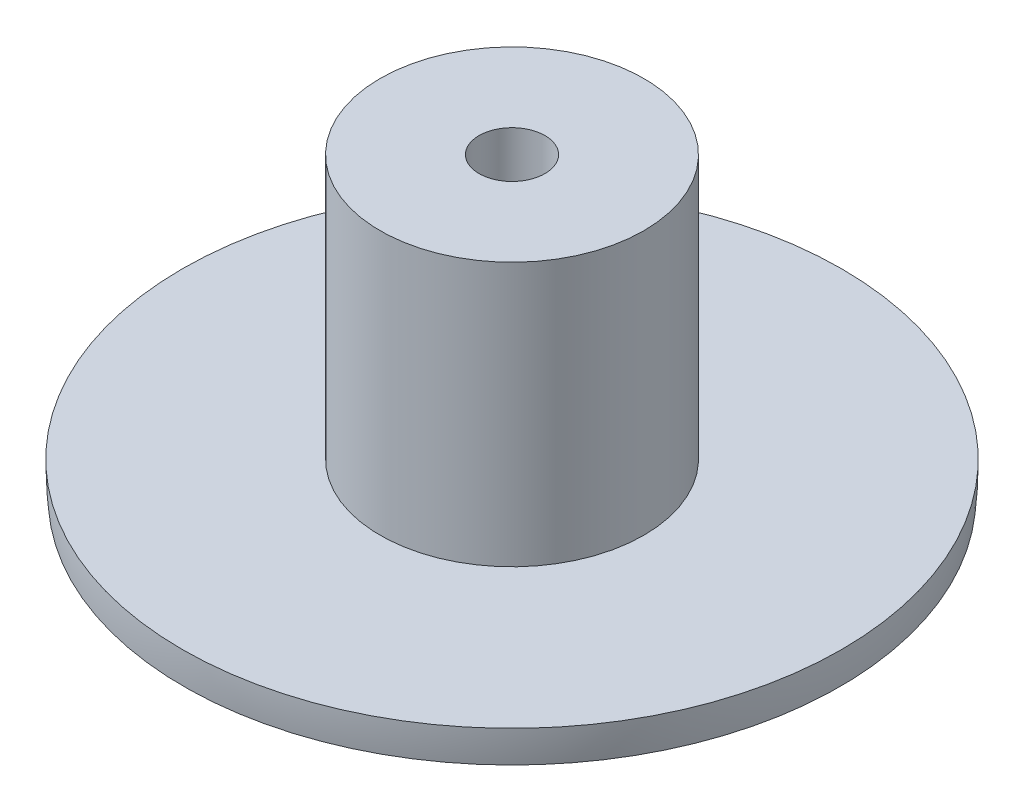
from build123d import *

# Parameters (mm, degrees)
SKETCH2_R           = 25.4
BOSS_EXTRUDE1_DEPTH = 50.8
SKETCH4_R           = 6.35
CUT_EXTRUDE1_DEPTH  = 87.884


with BuildPart() as part:
    # Sketch1 → Revolve2 (revolve)
    with BuildSketch(Plane.XY, mode=Mode.PRIVATE) as revolve2_sk:
        with BuildLine():
            Line((0, 0), (63.5, 0))
            ThreePointArc((63.5, 0), (63.420375643, -3.178986216), (63.181702256, -6.35))
            Line((63.181702256, -6.35), (0, -6.35))
            Line((0, -6.35), (0, 0))
        make_face()
    revolve(revolve2_sk.sketch.rotate(Axis((0, 0, 0), (0, -1, 0)), 180), axis=Axis((0, 0, 0), (0, -1, 0)))

    # Sketch2 → Boss-Extrude1 (add)
    with BuildSketch(Plane(origin=(0, 0, 0), x_dir=(1, 0, 0), z_dir=(0, 1, 0))):
        with Locations(Location((0, 0, 0), (0, 0, 180))):
            Circle(SKETCH2_R)
    extrude(amount=BOSS_EXTRUDE1_DEPTH)

    # Sketch4 → Cut-Extrude1 (cut)
    with BuildSketch(Plane(origin=(0, 50.8, 0), x_dir=(1, 0, 0), z_dir=(0, 1, 0))):
        with Locations(Location((0, 0, 0), (0, 0, 180))):
            Circle(SKETCH4_R)
    extrude(amount=-CUT_EXTRUDE1_DEPTH, mode=Mode.SUBTRACT)


solid = part.part
